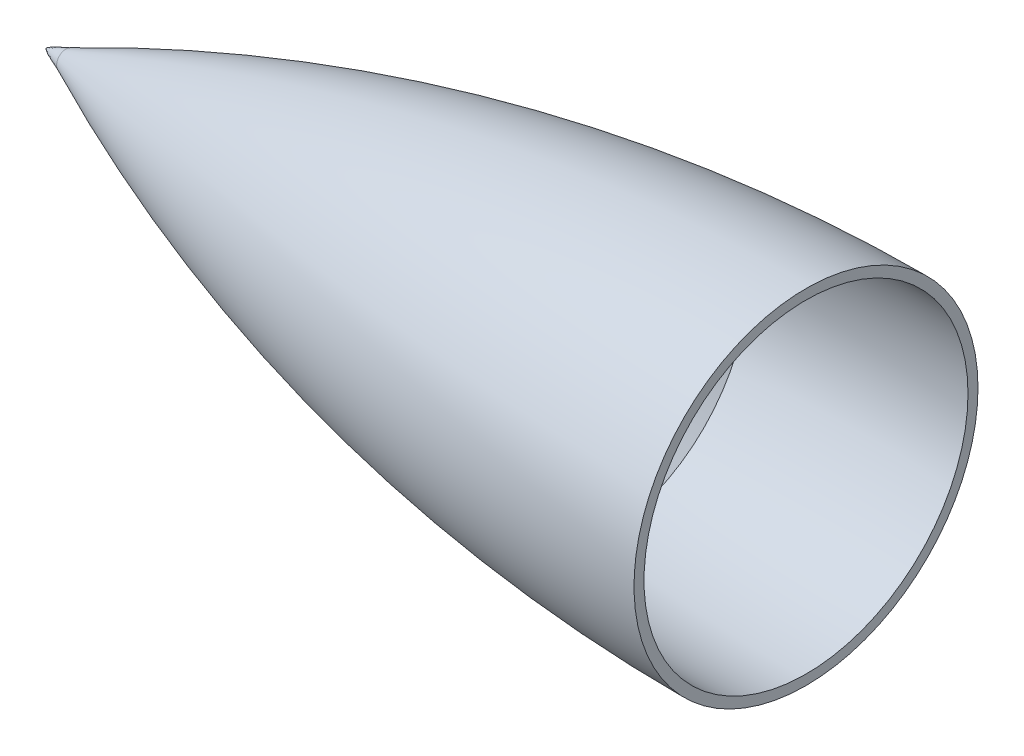
from build123d import *


with BuildPart() as part:
    # Sketch2 → Revolve3 (revolve)
    with BuildSketch(Plane.XY, mode=Mode.PRIVATE) as revolve3_sk:
        with BuildLine():
            Line((0, 441.26744186), (0, 438.76744186))
            ThreePointArc((0, 438.76744186), (-26.04587247, 437.993699229), (-51.999883967, 435.67520024))
            Line((-51.999883967, 435.67520024), (-54.872218632, 432.802865575))
            ThreePointArc((-54.872218632, 432.802865575), (-117.74890794, 420.076749543), (-178.079548465, 398.26744186))
            Line((-178.079548465, 398.26744186), (-190, 398.26744186))
            ThreePointArc((-190, 398.26744186), (-97.402515368, 430.38320744), (0, 441.26744186))
        make_face()
    revolve(revolve3_sk.sketch.rotate(Axis((-190, 398.26744186, 0), (-1, 0, 0)), 90), axis=Axis((-190, 398.26744186, 0), (-1, 0, 0)))

    # Sketch3 → Cut-Revolve3 (revolve, cut)
    with BuildSketch(Plane.XY, mode=Mode.PRIVATE) as cut_revolve3_sk:
        with BuildLine():
            Line((-190, 398.26744186), (-185, 398.26744186))
            Line((-185, 398.26744186), (-185, 400.614472088))
            ThreePointArc((-185, 400.614472088), (-187.503672331, 399.448780332), (-190, 398.26744186))
        make_face()
    revolve(cut_revolve3_sk.sketch.rotate(Axis((-190, 398.26744186, 0), (1, 0, 0)), 180), axis=Axis((-190, 398.26744186, 0), (1, 0, 0)), mode=Mode.SUBTRACT)

    # Sketch4 → Revolve4 (revolve)
    with BuildSketch(Plane.XY, mode=Mode.PRIVATE) as revolve4_sk:
        with BuildLine():
            Line((-185, 398.26744186), (-185, 400.614472088))
            add(Edge.make_bspline(
                [(-185, 400.614472088), (-186.994315071, 399.772437375), (-189.334509225, 399.059068758), (-189.991001923, 398.26744186)],
                knots=[0, 0, 0, 0, 1, 1, 1, 1], degree=3))
            Line((-189.991001923, 398.26744186), (-185, 398.26744186))
        make_face()
    revolve(revolve4_sk.sketch.rotate(Axis((-185, 398.26744186, 0), (-1, 0, 0)), 180), axis=Axis((-185, 398.26744186, 0), (-1, 0, 0)))


solid = part.part
